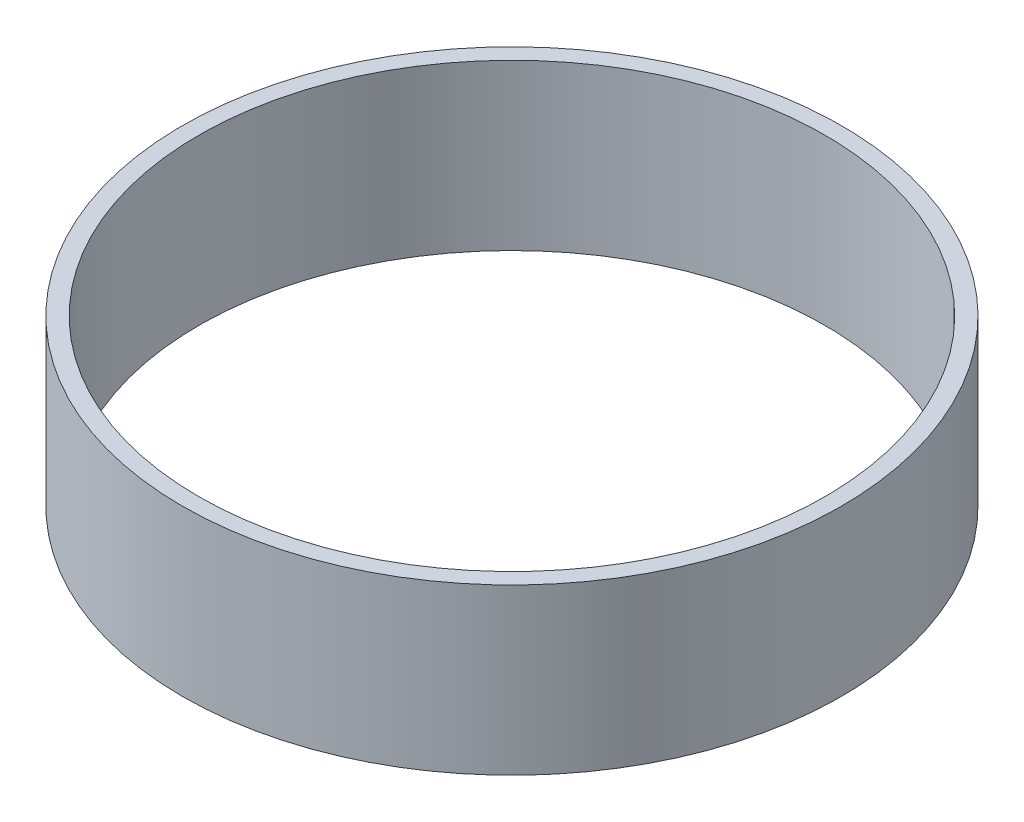
from build123d import *

# Parameters (mm, degrees)
SKETCH1_R           = 50.8
SKETCH1_R_2         = 48.26
BOSS_EXTRUDE1_DEPTH = 25.4


with BuildPart() as part:
    # Sketch1 → Boss-Extrude1 (new body)
    with BuildSketch(Plane(origin=(0, 0, 0), x_dir=(1, 0, 0), z_dir=(0, 1, 0))):
        with Locations(Location((0, 0, 0), (0, 0, 270))):
            Circle(SKETCH1_R)
        with Locations(Location((0, 0, 0), (0, 0, 270))):
            Circle(SKETCH1_R_2, mode=Mode.SUBTRACT)
    extrude(amount=BOSS_EXTRUDE1_DEPTH)


solid = part.part
